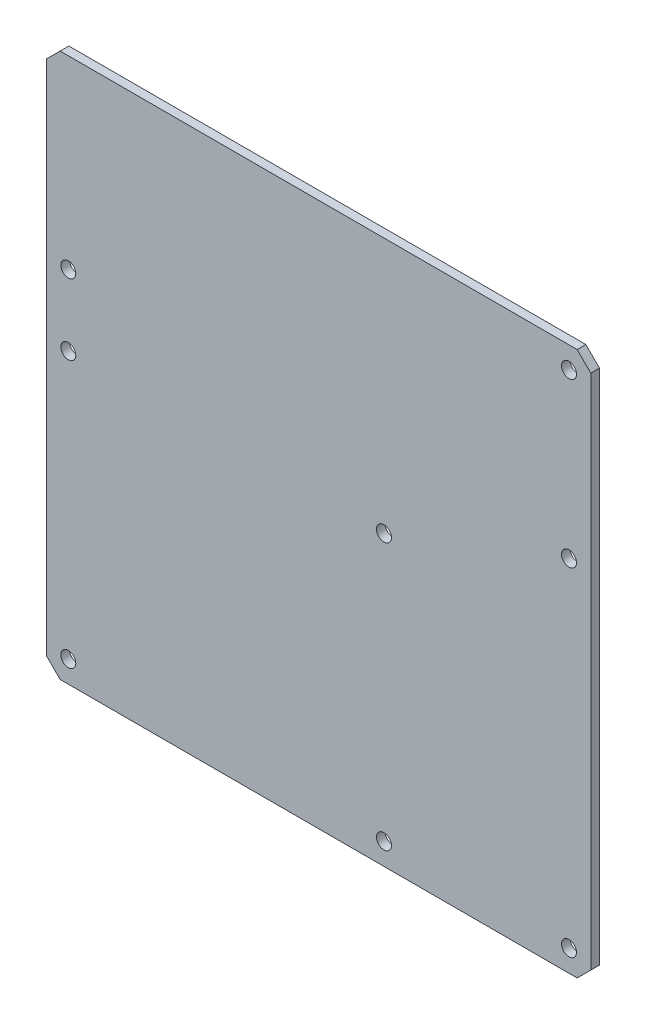
from build123d import *

# Parameters (mm, degrees)
ESQUISSE1_R        = 1.375
BOSS_EXTRU_1_DEPTH = 1.6


with BuildPart() as part:
    # Esquisse1 → Boss.-Extru.1 (new body)
    with BuildSketch(Plane.XY):
        Polygon((-58.367632909, -49.277777778), (-55.867632909, -51.777777778), (39.132367091, -51.777777778), (41.632367091, -49.277777778), (41.632367091, 45.722222222), (39.132367091, 48.222222222), (-55.867632909, 48.222222222), (-58.367632909, 45.722222222), align=None)
        with Locations((-54.367632909, -47.777777778)):
            Circle(ESQUISSE1_R, mode=Mode.SUBTRACT)
        with Locations((3.632367091, -47.777777778)):
            Circle(ESQUISSE1_R, mode=Mode.SUBTRACT)
        with Locations((37.632367091, -47.777777778)):
            Circle(ESQUISSE1_R, mode=Mode.SUBTRACT)
        with Locations((-54.367632909, 1.222222222)):
            Circle(ESQUISSE1_R, mode=Mode.SUBTRACT)
        with Locations((-54.367632909, 14.222222222)):
            Circle(ESQUISSE1_R, mode=Mode.SUBTRACT)
        with Locations((3.632367091, 1.222222222)):
            Circle(ESQUISSE1_R, mode=Mode.SUBTRACT)
        with Locations((37.632367091, 14.222222222)):
            Circle(ESQUISSE1_R, mode=Mode.SUBTRACT)
        with Locations((37.632367091, 44.222222222)):
            Circle(ESQUISSE1_R, mode=Mode.SUBTRACT)
    extrude(amount=BOSS_EXTRU_1_DEPTH)


solid = part.part
